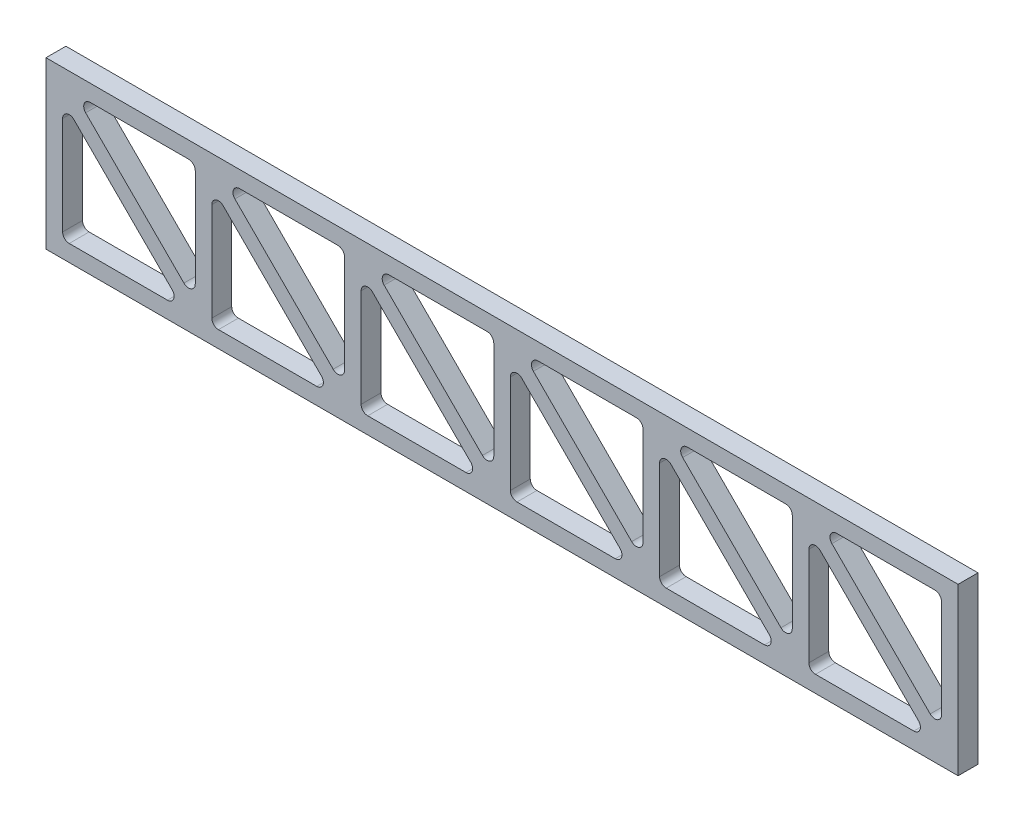
from build123d import *

# Parameters (mm, degrees)
SKETCH1_W           = 50
SKETCH1_H           = 50
BOSS_EXTRUDE1_DEPTH = 6
LPATTERN1_COUNT     = 6
LPATTERN1_PITCH     = 45


with BuildPart() as part:
    # Sketch1 → Boss-Extrude1 (new body)
    with BuildSketch(Plane.XY):
        with Locations((25, 25)):
            Rectangle(SKETCH1_W, SKETCH1_H)
        with BuildLine():
            Line((7, 5), (36.636038969, 5))
            ThreePointArc((36.636038969, 5), (38.483798034, 6.234633135), (38.050252532, 8.414213562))
            Line((38.050252532, 8.414213562), (8.414213562, 38.050252532))
            ThreePointArc((8.414213562, 38.050252532), (6.234633135, 38.483798034), (5, 36.636038969))
            Line((5, 36.636038969), (5, 7))
            ThreePointArc((5, 7), (5.585786438, 5.585786438), (7, 5))
        make_face(mode=Mode.SUBTRACT)
        with BuildLine():
            Line((13.363961031, 45), (43, 45))
            ThreePointArc((43, 45), (44.414213562, 44.414213562), (45, 43))
            Line((45, 43), (45, 13.363961031))
            ThreePointArc((45, 13.363961031), (43.765366865, 11.516201966), (41.585786438, 11.949747468))
            Line((41.585786438, 11.949747468), (11.949747468, 41.585786438))
            ThreePointArc((11.949747468, 41.585786438), (11.516201966, 43.765366865), (13.363961031, 45))
        make_face(mode=Mode.SUBTRACT)
    boss_extrude1 = extrude(amount=BOSS_EXTRUDE1_DEPTH)

    # LPattern1: Boss-Extrude1 ×6
    with Locations(*[(i * LPATTERN1_PITCH, 0, 0) for i in range(1, LPATTERN1_COUNT)]):
        add(boss_extrude1)


solid = part.part
